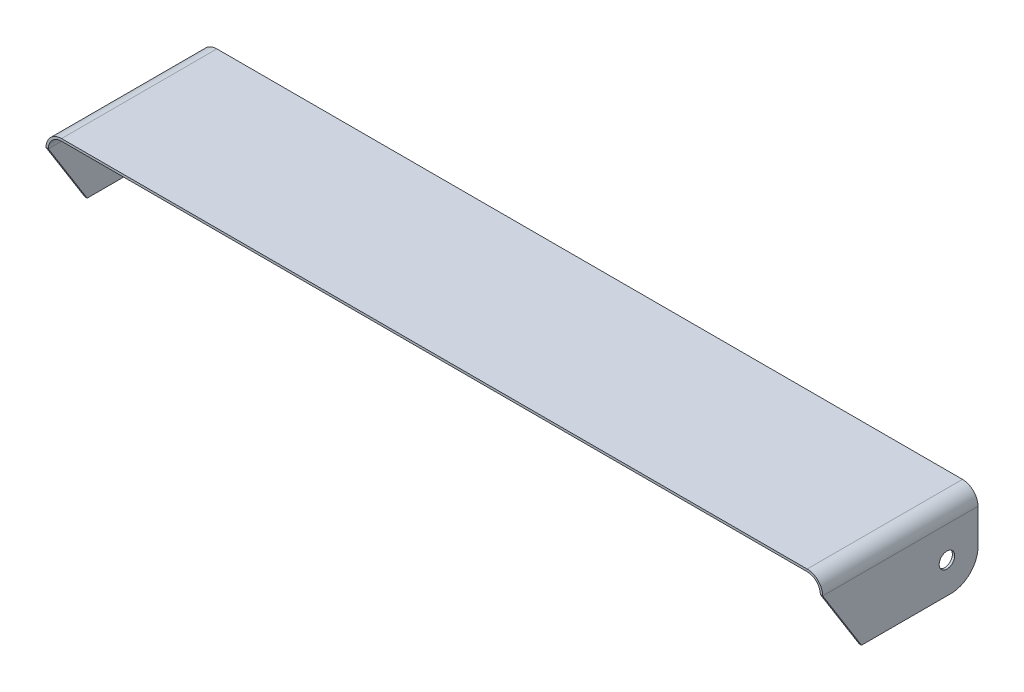
from build123d import *

# Parameters (mm, degrees)
BOSS_EXTRUDE1_DEPTH = 100
CUT_EXTRUDE1_DEPTH  = 1010.950493836
SKETCH3_R           = 10
CUT_EXTRUDE2_DEPTH  = 1010.950493836
FILLET1_R           = 35
FILLET2_R           = 35


with BuildPart() as part:
    # Sketch1 → Boss-Extrude1 (new, symmetric)
    with BuildSketch(Plane.XY):
        with BuildLine():
            Line((-500, 0), (-500, 80))
            ThreePointArc((-500, 80), (-494.142135624, 94.142135624), (-480, 100))
            Line((-480, 100), (480, 100))
            ThreePointArc((480, 100), (494.142135624, 94.142135624), (500, 80))
            Line((500, 80), (500, 0))
            Line((500, 0), (497, 0))
            Line((497, 0), (497, 80))
            ThreePointArc((497, 80), (492.02081528, 92.02081528), (480, 97))
            Line((480, 97), (-480, 97))
            ThreePointArc((-480, 97), (-492.02081528, 92.02081528), (-497, 80))
            Line((-497, 80), (-497, 0))
            Line((-497, 0), (-500, 0))
        make_face()
    extrude(amount=BOSS_EXTRUDE1_DEPTH, both=True)

    # Sketch2 → Cut-Extrude1 (cut, through all)
    with BuildSketch(Plane(origin=(500, 0, 0), x_dir=(0, 0, -1), z_dir=(1, 0, 0))):
        Polygon((-100, 80), (-100, 0), (-50, 0), align=None)
    extrude(amount=-CUT_EXTRUDE1_DEPTH, mode=Mode.SUBTRACT)

    # Sketch3 → Cut-Extrude2 (cut, through all)
    with BuildSketch(Plane(origin=(500, 0, 0), x_dir=(0, 0, -1), z_dir=(1, 0, 0))):
        with Locations((60, 40)):
            Circle(SKETCH3_R)
    extrude(amount=-CUT_EXTRUDE2_DEPTH, mode=Mode.SUBTRACT)

    # Fillet1
    fillet1_edges = [part.edges().sort_by_distance(p)[0] for p in [
        (498.5, 0, -100),
    ]]
    fillet(fillet1_edges, radius=FILLET1_R)

    # Fillet2
    fillet2_edges = [part.edges().sort_by_distance(p)[0] for p in [
        (-498.5, 0, -100),
    ]]
    fillet(fillet2_edges, radius=FILLET2_R)


solid = part.part
